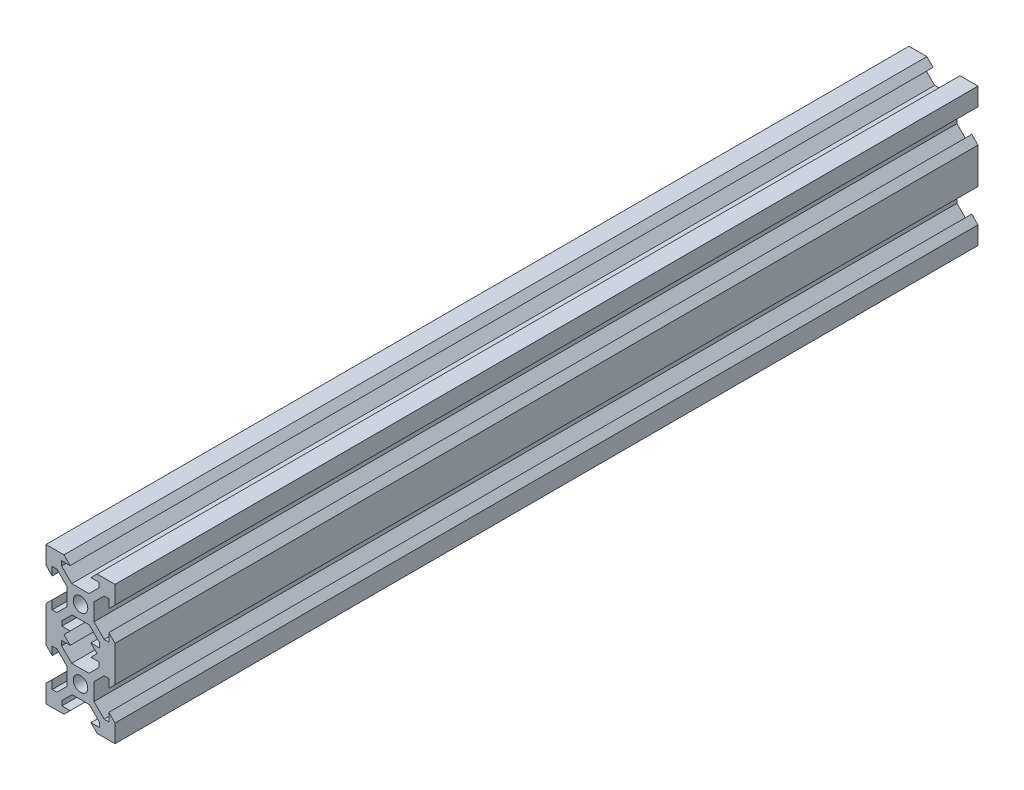
from build123d import *

# Parameters (mm, degrees)
CROQUIS1_R              = 2.1
SALIENTE_EXTRUIR1_DEPTH = 250
MATRIZL1_COUNT          = 2
MATRIZL1_PITCH          = 20


with BuildPart() as part:
    # Croquis1 → Saliente-Extruir1 (new body)
    with BuildSketch(Plane.XY):
        Polygon((3, 8.2), (5.4, 8.2), (5.4, 6.85), (2.45, 3.9), (-2.55, 3.9), (-5.5, 6.85), (-5.5, 8.2), (-3, 8.2), (-4.8, 10), (-10, 10), (-10, 4.8), (-8.2, 3), (-8.2, 5.4), (-6.85, 5.4), (-3.9, 2.45), (-3.9, -2.55), (-6.85, -5.5), (-8.2, -5.5), (-8.2, -3), (-10, -4.8), (-10, -10), (-4.8, -10), (-3, -8.2), (-5.4, -8.2), (-5.4, -6.85), (-2.45, -3.9), (2.55, -3.9), (5.5, -6.85), (5.5, -8.2), (3, -8.2), (4.8, -10), (10, -10), (10, -4.8), (8.2, -3), (8.2, -5.4), (6.85, -5.4), (3.9, -2.45), (3.9, 2.55), (6.85, 5.5), (8.2, 5.5), (8.2, 3), (10, 4.8), (10, 10), (4.8, 10), align=None)
        Circle(CROQUIS1_R, mode=Mode.SUBTRACT)
    saliente_extruir1 = extrude(amount=SALIENTE_EXTRUIR1_DEPTH)

    # MatrizL1: Saliente-Extruir1 ×2
    with Locations(*[(0, -i * MATRIZL1_PITCH, 0) for i in range(1, MATRIZL1_COUNT)]):
        add(saliente_extruir1)


solid = part.part
